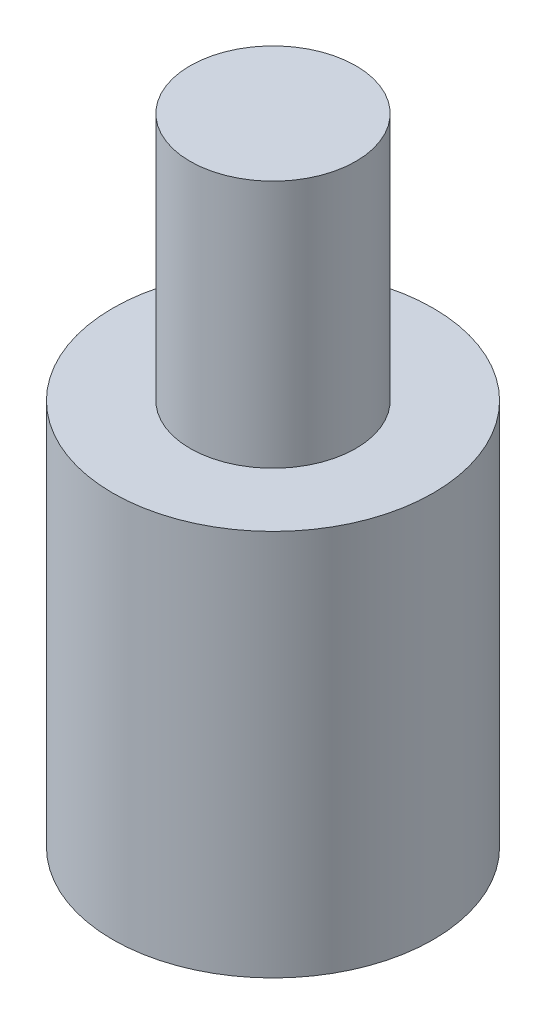
from build123d import *

# Parameters (mm, degrees)
OD_BASE_R           = 2.9
STANDOFF_BASE_DEPTH = 7
OD_POST_MOUNT_R     = 1.5
STANDOFF_POST_DEPTH = 4.5
ID_POST_MOUNT_R     = 1.2195
POST_MOUNT_DEPTH    = 3


with BuildPart() as part:
    # OD_base → standoff_base (new body)
    with BuildSketch(Plane(origin=(0, 0, 0), x_dir=(1, 0, 0), z_dir=(0, 1, 0))):
        with Locations(Location((0, 0, 0), (0, 0, 270))):
            Circle(OD_BASE_R)
    extrude(amount=STANDOFF_BASE_DEPTH)

    # OD_post_mount → standoff_post (add)
    with BuildSketch(Plane(origin=(0, 7, 0), x_dir=(1, 0, 0), z_dir=(0, 1, 0))):
        with Locations(Location((0, 0, 0), (0, 0, 270))):
            Circle(OD_POST_MOUNT_R)
    extrude(amount=STANDOFF_POST_DEPTH)

    # ID_post_mount → post_mount (cut)
    with BuildSketch(Plane.XZ):
        with Locations(Location((0, 0, 0), (0, 0, 270))):
            Circle(ID_POST_MOUNT_R)
    extrude(amount=-POST_MOUNT_DEPTH, mode=Mode.SUBTRACT)


solid = part.part
